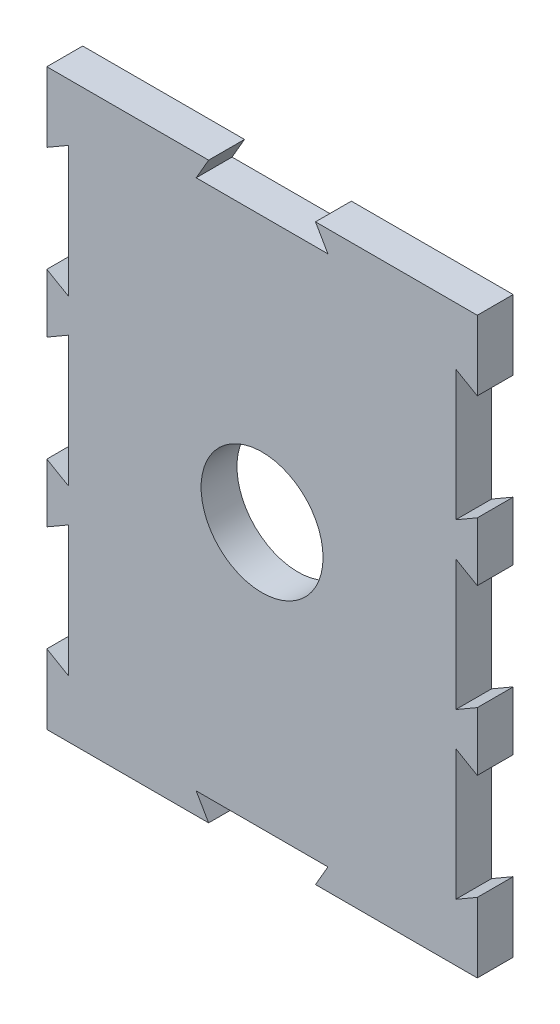
from build123d import *

# Parameters (mm, degrees)
SKETCH4_R           = 8.5
BOSS_EXTRUDE1_DEPTH = 5


with BuildPart() as part:
    # Sketch4 → Boss-Extrude1 (new body)
    with BuildSketch(Plane(origin=(0, 0, 0), x_dir=(0, 1, 0), z_dir=(0, 0, 1))):
        Polygon((-40, -30), (-30.267949192, -30), (-32, -27), (-22.90673326, -27), (-13.813466521, -27), (-15.545517328, -30), (-7.361215932, -30), (-9.09326674, -27), (3.1e-08, -27), (9.09326674, -27), (7.361215932, -30), (15.545517328, -30), (13.813466521, -27), (22.90673326, -27), (32, -27), (30.267949192, -30), (40, -30), (40, -7.447818473), (37, -9.17986928), (37, -5.1e-08), (37, 9.17986928), (40, 7.447818473), (40, 30), (30.267949192, 30), (32, 27), (22.90673326, 27), (13.813466521, 27), (15.545517328, 30), (7.361215932, 30), (9.09326674, 27), (0, 27), (-9.09326674, 27), (-7.361215932, 30), (-15.545517328, 30), (-13.813466521, 27), (-22.90673326, 27), (-32, 27), (-30.267949192, 30), (-40, 30), (-40, 7.447818473), (-37, 9.17986928), (-37, 0), (-37, -9.17986928), (-40, -7.447818473), align=None)
        with Locations(Location((0, 0, 0), (0, 0, 270))):
            Circle(SKETCH4_R, mode=Mode.SUBTRACT)
    extrude(amount=BOSS_EXTRUDE1_DEPTH)


solid = part.part
